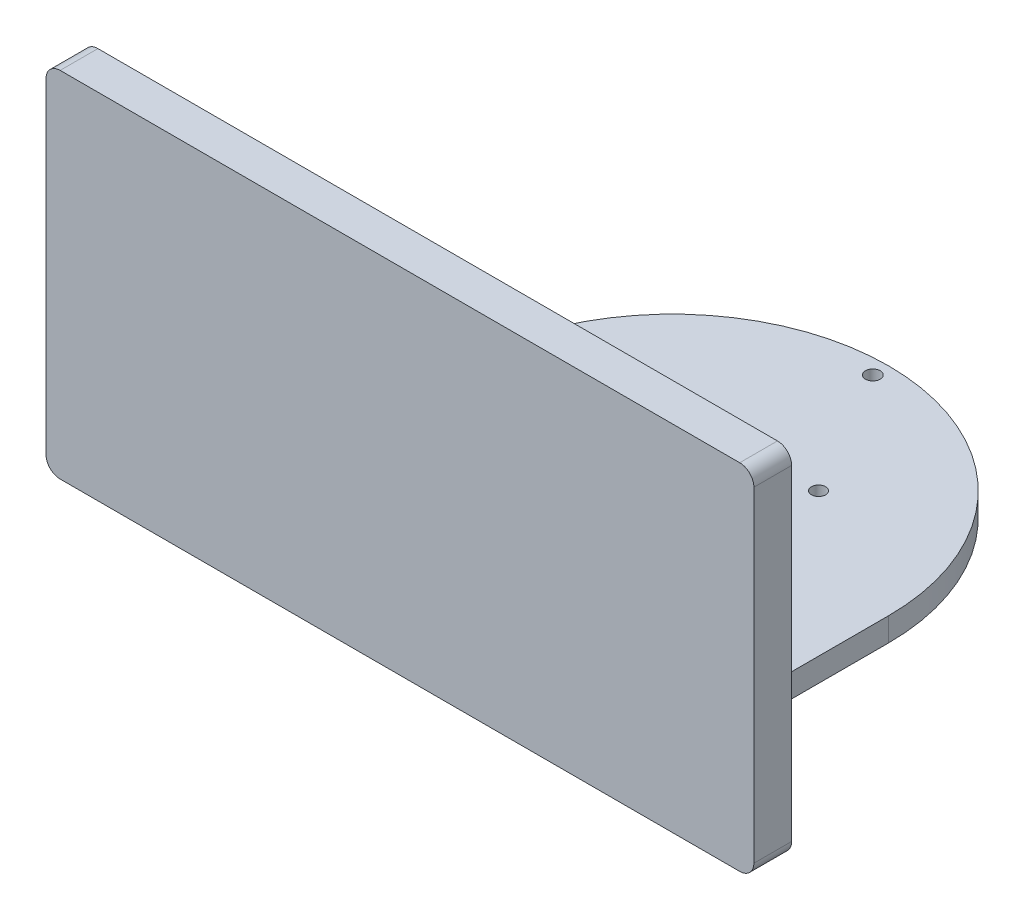
from build123d import *

# Parameters (mm, degrees)
SKETCH1_R           = 45.85
BOSS_EXTRUDE1_DEPTH = 5
SKETCH2_R           = 1.565
CUT_EXTRUDE1_DEPTH  = 10
SKETCH3_R           = 1.5
SKETCH3_R_2         = 7
CUT_EXTRUDE2_DEPTH  = 10
BOSS_EXTRUDE2_START = -5
BOSS_EXTRUDE2_DEPTH = 5
SKETCH5_W           = 150
SKETCH5_H           = 8
BOSS_EXTRUDE3_DEPTH = 75
FILLET1_R           = 3
FILLET2_R           = 3


with BuildPart() as part:
    # Sketch1 → Boss-Extrude1 (new body)
    with BuildSketch(Plane(origin=(0, 0, 0), x_dir=(1, 0, 0), z_dir=(0, 1, 0))):
        with Locations(Location((0, 0, 0), (0, 0, 270))):
            Circle(SKETCH1_R)
    extrude(amount=BOSS_EXTRUDE1_DEPTH)

    # Sketch2 → Cut-Extrude1 (cut)
    with BuildSketch(Plane(origin=(0, 5, 0), x_dir=(1, 0, 0), z_dir=(0, 1, 0))):
        with Locations(Location((0, 42.5, 0), (0, 0, 270))):
            Circle(SKETCH2_R)
        with Locations(Location((36.806079661, -21.25, 0), (0, 0, 270))):
            Circle(SKETCH2_R)
        with Locations(Location((-36.806079661, -21.25, 0), (0, 0, 270))):
            Circle(SKETCH2_R)
    extrude(amount=-CUT_EXTRUDE1_DEPTH, mode=Mode.SUBTRACT)

    # Sketch3 → Cut-Extrude2 (cut)
    with BuildSketch(Plane(origin=(0, 5, 0), x_dir=(1, 0, 0), z_dir=(0, 1, 0))):
        with Locations(Location((-15.5, 15.5, 0), (0, 0, 270))):
            Circle(SKETCH3_R)
        with Locations(Location((15.5, 15.5, 0), (0, 0, 270))):
            Circle(SKETCH3_R)
        with Locations(Location((15.5, -15.5, 0), (0, 0, 270))):
            Circle(SKETCH3_R)
        with Locations(Location((-15.5, -15.5, 0), (0, 0, 270))):
            Circle(SKETCH3_R)
        with Locations(Location((0, 0, 0), (0, 0, 270))):
            Circle(SKETCH3_R_2)
    extrude(amount=-CUT_EXTRUDE2_DEPTH, mode=Mode.SUBTRACT)

    # Sketch4 → Boss-Extrude2 (add)
    with BuildSketch(Plane(origin=(0, 5, 0), x_dir=(1, 0, 0), z_dir=(0, 1, 0)).offset(BOSS_EXTRUDE2_START)):
        with BuildLine():
            Line((-45.85, 0), (-45.85, -57.708767277))
            Line((-45.85, -57.708767277), (45.85, -57.708767277))
            Line((45.85, -57.708767277), (45.85, 0))
            ThreePointArc((45.85, 0), (0, -45.85), (-45.85, 0))
        make_face()
    extrude(amount=BOSS_EXTRUDE2_DEPTH)

    # Sketch5 → Boss-Extrude3 (add)
    with BuildSketch(Plane(origin=(0, 0, 0), x_dir=(1, 0, 0), z_dir=(0, 1, 0))):
        with Locations((0, -53.708767277)):
            Rectangle(SKETCH5_W, SKETCH5_H)
    extrude(amount=BOSS_EXTRUDE3_DEPTH)

    # Fillet1
    fillet1_edges = [part.edges().sort_by_distance(p)[0] for p in [
        (-45.85, 2.5, 49.708767277),
        (0, 5, 49.708767277),
        (45.85, 2.5, 49.708767277),
    ]]
    fillet(fillet1_edges, radius=FILLET1_R)

    # Fillet2
    fillet2_edges = [part.edges().sort_by_distance(p)[0] for p in [
        (-75, 0, 53.708767277),
        (75, 0, 53.708767277),
        (-75, 75, 53.708767277),
        (75, 75, 53.708767277),
    ]]
    fillet(fillet2_edges, radius=FILLET2_R)


solid = part.part
